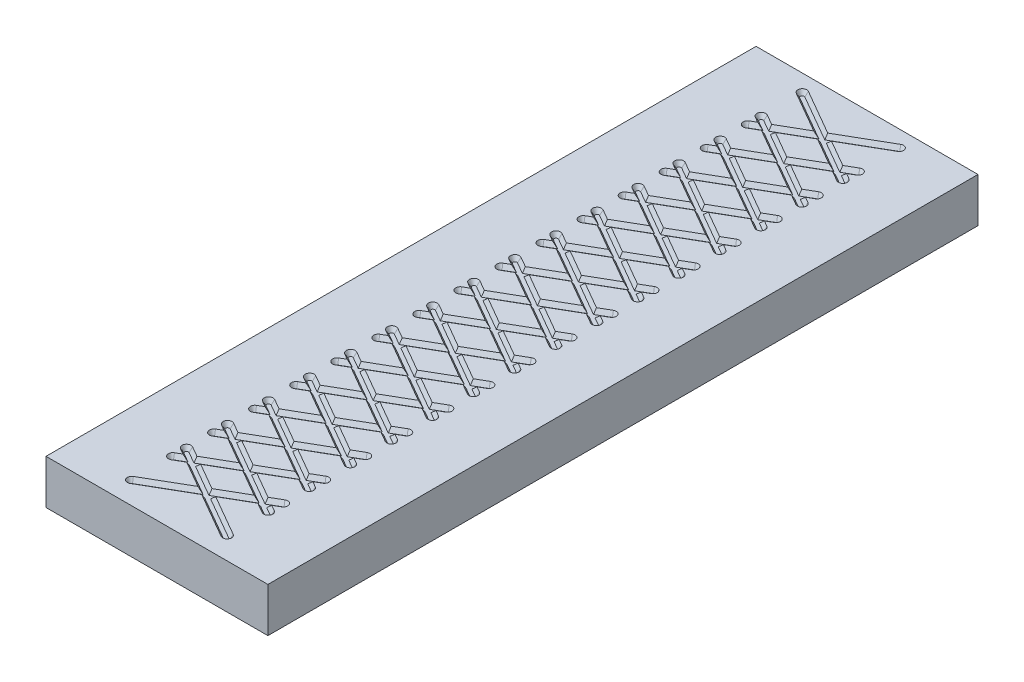
from build123d import *

# Parameters (mm, degrees)
SKETCH1_W               = 50
SKETCH1_H               = 10
BOSS_EXTRUDE1_DEPTH     = 160
CUT_EXTRUDE2_DEPTH      = 1
CUT_EXTRUDE2_DRAFT      = -30
LPATTERN1_COPY_1_DEPTH  = 1
LPATTERN1_COPY_1_DRAFT  = -30
LPATTERN1_COPY_2_DEPTH  = 1
LPATTERN1_COPY_2_DRAFT  = -30
LPATTERN1_COPY_3_DEPTH  = 1
LPATTERN1_COPY_3_DRAFT  = -30
LPATTERN1_COPY_4_DEPTH  = 1
LPATTERN1_COPY_4_DRAFT  = -30
LPATTERN1_COPY_5_DEPTH  = 1
LPATTERN1_COPY_5_DRAFT  = -30
LPATTERN1_COPY_6_DEPTH  = 1
LPATTERN1_COPY_6_DRAFT  = -30
LPATTERN1_COPY_7_DEPTH  = 1
LPATTERN1_COPY_7_DRAFT  = -30
LPATTERN1_COPY_8_DEPTH  = 1
LPATTERN1_COPY_8_DRAFT  = -30
LPATTERN1_COPY_9_DEPTH  = 1
LPATTERN1_COPY_9_DRAFT  = -30
LPATTERN1_COPY_10_DEPTH = 1
LPATTERN1_COPY_10_DRAFT = -30
LPATTERN1_COPY_11_DEPTH = 1
LPATTERN1_COPY_11_DRAFT = -30
LPATTERN1_COPY_12_DEPTH = 1
LPATTERN1_COPY_12_DRAFT = -30
LPATTERN1_COPY_13_DEPTH = 1
LPATTERN1_COPY_13_DRAFT = -30
LPATTERN1_COPY_14_DEPTH = 1
LPATTERN1_COPY_14_DRAFT = -30
LPATTERN1_COPY_15_DEPTH = 1
LPATTERN1_COPY_15_DRAFT = -30
SKETCH4_W               = 4.9
SKETCH4_H               = 9.9
CUT_EXTRUDE3_DEPTH      = 3.05
FILLET1_R               = 1


with BuildPart() as part:
    # Sketch1 → Boss-Extrude1 (new body)
    with BuildSketch(Plane.XY):
        with Locations((25, 5)):
            Rectangle(SKETCH1_W, SKETCH1_H)
    extrude(amount=-BOSS_EXTRUDE1_DEPTH)


with BuildPart() as cut_extrude2_tool:
    # Sketch2 → Cut-Extrude2 (with draft: the straight prism first)
    with BuildSketch(Plane(origin=(0, 10, 0), x_dir=(1, 0, 0), z_dir=(0, 1, 0))):
        with BuildLine():
            ThreePointArc((13.77723133, 144.666025404), (13.411205926, 143.3), (14.77723133, 142.933974596))
            Line((14.77723133, 142.933974596), (25, 148.83609284))
            Line((25, 148.83609284), (35.325317547, 142.874767974))
            ThreePointArc((35.325317547, 142.874767974), (36.691342951, 143.240793378), (36.325317547, 144.606818782))
            Line((36.325317547, 144.606818782), (27, 149.990793378))
            Line((27, 149.990793378), (36.427866425, 155.433974596))
            ThreePointArc((36.427866425, 155.433974596), (36.793891829, 156.8), (35.427866425, 157.166025404))
            Line((35.427866425, 157.166025404), (25, 151.145493916))
            Line((25, 151.145493916), (14.674682453, 157.106818782))
            ThreePointArc((14.674682453, 157.106818782), (13.308657049, 156.740793378), (13.674682453, 155.374767974))
            Line((13.674682453, 155.374767974), (23, 149.990793378))
            Line((23, 149.990793378), (13.77723133, 144.666025404))
        make_face()
    extrude(amount=-CUT_EXTRUDE2_DEPTH)
    # Cut-Extrude2: the draft: its side faces are tilted about the plane it starts from
    cut_extrude2_sides = [cut_extrude2_tool.faces().sort_by_distance(p)[0] for p in [
        (18.337341226, 9.5, -152.682780676),
        (18.388615665, 9.5, -147.328409391),
        (13.411205926, 9.5, -143.3),
        (19.888615665, 9.5, -145.885033718),
        (30.162658774, 9.5, -145.855430407),
        (36.691342951, 9.5, -143.240793378),
        (31.662658774, 9.5, -147.29880608),
        (31.713933212, 9.5, -152.712383987),
        (36.793891829, 9.5, -156.8),
        (30.213933212, 9.5, -154.15575966),
        (19.837341226, 9.5, -154.126156349),
        (13.308657049, 9.5, -156.740793378),
    ]]
    draft(cut_extrude2_sides, Plane(origin=(0, 10, 0), x_dir=(1, 0, 0), z_dir=(0, 1, 0)), CUT_EXTRUDE2_DRAFT)


with BuildPart() as part_1:
    add(part.part)

    # Cut-Extrude2: cut by cut_extrude2_tool
    add(cut_extrude2_tool.part, mode=Mode.SUBTRACT)


with BuildPart() as lpattern1_copy_1_tool:
    # LPattern1 copy 1 sketch → LPattern1 copy 1 (with draft: the straight prism first)
    with BuildSketch(Plane(origin=(0, 10, 9.25), x_dir=(1, 0, 0), z_dir=(0, 1, 0))):
        with BuildLine():
            ThreePointArc((13.77723133, 144.666025404), (13.411205926, 143.3), (14.77723133, 142.933974596))
            Line((14.77723133, 142.933974596), (25, 148.83609284))
            Line((25, 148.83609284), (35.325317547, 142.874767974))
            ThreePointArc((35.325317547, 142.874767974), (36.691342951, 143.240793378), (36.325317547, 144.606818782))
            Line((36.325317547, 144.606818782), (27, 149.990793378))
            Line((27, 149.990793378), (36.427866425, 155.433974596))
            ThreePointArc((36.427866425, 155.433974596), (36.793891829, 156.8), (35.427866425, 157.166025404))
            Line((35.427866425, 157.166025404), (25, 151.145493916))
            Line((25, 151.145493916), (14.674682453, 157.106818782))
            ThreePointArc((14.674682453, 157.106818782), (13.308657049, 156.740793378), (13.674682453, 155.374767974))
            Line((13.674682453, 155.374767974), (23, 149.990793378))
            Line((23, 149.990793378), (13.77723133, 144.666025404))
        make_face()
    extrude(amount=-LPATTERN1_COPY_1_DEPTH)
    # LPattern1 copy 1: the draft: its side faces are tilted about the plane it starts from
    lpattern1_copy_1_sides = [lpattern1_copy_1_tool.faces().sort_by_distance(p)[0] for p in [
        (18.337341226, 9.5, -143.432780676),
        (18.388615665, 9.5, -138.078409391),
        (13.411205926, 9.5, -134.05),
        (19.888615665, 9.5, -136.635033718),
        (30.162658774, 9.5, -136.605430407),
        (36.691342951, 9.5, -133.990793378),
        (31.662658774, 9.5, -138.04880608),
        (31.713933212, 9.5, -143.462383987),
        (36.793891829, 9.5, -147.55),
        (30.213933212, 9.5, -144.90575966),
        (19.837341226, 9.5, -144.876156349),
        (13.308657049, 9.5, -147.490793378),
    ]]
    draft(lpattern1_copy_1_sides, Plane(origin=(0, 10, 9.25), x_dir=(1, 0, 0), z_dir=(0, 1, 0)), LPATTERN1_COPY_1_DRAFT)


with BuildPart() as part_2:
    add(part_1.part)

    # LPattern1 copy 1: cut by lpattern1_copy_1_tool
    add(lpattern1_copy_1_tool.part, mode=Mode.SUBTRACT)


with BuildPart() as lpattern1_copy_2_tool:
    # LPattern1 copy 2 sketch → LPattern1 copy 2 (with draft: the straight prism first)
    with BuildSketch(Plane(origin=(0, 10, 18.5), x_dir=(1, 0, 0), z_dir=(0, 1, 0))):
        with BuildLine():
            ThreePointArc((13.77723133, 144.666025404), (13.411205926, 143.3), (14.77723133, 142.933974596))
            Line((14.77723133, 142.933974596), (25, 148.83609284))
            Line((25, 148.83609284), (35.325317547, 142.874767974))
            ThreePointArc((35.325317547, 142.874767974), (36.691342951, 143.240793378), (36.325317547, 144.606818782))
            Line((36.325317547, 144.606818782), (27, 149.990793378))
            Line((27, 149.990793378), (36.427866425, 155.433974596))
            ThreePointArc((36.427866425, 155.433974596), (36.793891829, 156.8), (35.427866425, 157.166025404))
            Line((35.427866425, 157.166025404), (25, 151.145493916))
            Line((25, 151.145493916), (14.674682453, 157.106818782))
            ThreePointArc((14.674682453, 157.106818782), (13.308657049, 156.740793378), (13.674682453, 155.374767974))
            Line((13.674682453, 155.374767974), (23, 149.990793378))
            Line((23, 149.990793378), (13.77723133, 144.666025404))
        make_face()
    extrude(amount=-LPATTERN1_COPY_2_DEPTH)
    # LPattern1 copy 2: the draft: its side faces are tilted about the plane it starts from
    lpattern1_copy_2_sides = [lpattern1_copy_2_tool.faces().sort_by_distance(p)[0] for p in [
        (18.337341226, 9.5, -134.182780676),
        (18.388615665, 9.5, -128.828409391),
        (13.411205926, 9.5, -124.8),
        (19.888615665, 9.5, -127.385033718),
        (30.162658774, 9.5, -127.355430407),
        (36.691342951, 9.5, -124.740793378),
        (31.662658774, 9.5, -128.79880608),
        (31.713933212, 9.5, -134.212383987),
        (36.793891829, 9.5, -138.3),
        (30.213933212, 9.5, -135.65575966),
        (19.837341226, 9.5, -135.626156349),
        (13.308657049, 9.5, -138.240793378),
    ]]
    draft(lpattern1_copy_2_sides, Plane(origin=(0, 10, 18.5), x_dir=(1, 0, 0), z_dir=(0, 1, 0)), LPATTERN1_COPY_2_DRAFT)


with BuildPart() as part_3:
    add(part_2.part)

    # LPattern1 copy 2: cut by lpattern1_copy_2_tool
    add(lpattern1_copy_2_tool.part, mode=Mode.SUBTRACT)


with BuildPart() as lpattern1_copy_3_tool:
    # LPattern1 copy 3 sketch → LPattern1 copy 3 (with draft: the straight prism first)
    with BuildSketch(Plane(origin=(0, 10, 27.75), x_dir=(1, 0, 0), z_dir=(0, 1, 0))):
        with BuildLine():
            ThreePointArc((13.77723133, 144.666025404), (13.411205926, 143.3), (14.77723133, 142.933974596))
            Line((14.77723133, 142.933974596), (25, 148.83609284))
            Line((25, 148.83609284), (35.325317547, 142.874767974))
            ThreePointArc((35.325317547, 142.874767974), (36.691342951, 143.240793378), (36.325317547, 144.606818782))
            Line((36.325317547, 144.606818782), (27, 149.990793378))
            Line((27, 149.990793378), (36.427866425, 155.433974596))
            ThreePointArc((36.427866425, 155.433974596), (36.793891829, 156.8), (35.427866425, 157.166025404))
            Line((35.427866425, 157.166025404), (25, 151.145493916))
            Line((25, 151.145493916), (14.674682453, 157.106818782))
            ThreePointArc((14.674682453, 157.106818782), (13.308657049, 156.740793378), (13.674682453, 155.374767974))
            Line((13.674682453, 155.374767974), (23, 149.990793378))
            Line((23, 149.990793378), (13.77723133, 144.666025404))
        make_face()
    extrude(amount=-LPATTERN1_COPY_3_DEPTH)
    # LPattern1 copy 3: the draft: its side faces are tilted about the plane it starts from
    lpattern1_copy_3_sides = [lpattern1_copy_3_tool.faces().sort_by_distance(p)[0] for p in [
        (18.337341226, 9.5, -124.932780676),
        (18.388615665, 9.5, -119.578409391),
        (13.411205926, 9.5, -115.55),
        (19.888615665, 9.5, -118.135033718),
        (30.162658774, 9.5, -118.105430407),
        (36.691342951, 9.5, -115.490793378),
        (31.662658774, 9.5, -119.54880608),
        (31.713933212, 9.5, -124.962383987),
        (36.793891829, 9.5, -129.05),
        (30.213933212, 9.5, -126.40575966),
        (19.837341226, 9.5, -126.376156349),
        (13.308657049, 9.5, -128.990793378),
    ]]
    draft(lpattern1_copy_3_sides, Plane(origin=(0, 10, 27.75), x_dir=(1, 0, 0), z_dir=(0, 1, 0)), LPATTERN1_COPY_3_DRAFT)


with BuildPart() as part_4:
    add(part_3.part)

    # LPattern1 copy 3: cut by lpattern1_copy_3_tool
    add(lpattern1_copy_3_tool.part, mode=Mode.SUBTRACT)


with BuildPart() as lpattern1_copy_4_tool:
    # LPattern1 copy 4 sketch → LPattern1 copy 4 (with draft: the straight prism first)
    with BuildSketch(Plane(origin=(0, 10, 37), x_dir=(1, 0, 0), z_dir=(0, 1, 0))):
        with BuildLine():
            ThreePointArc((13.77723133, 144.666025404), (13.411205926, 143.3), (14.77723133, 142.933974596))
            Line((14.77723133, 142.933974596), (25, 148.83609284))
            Line((25, 148.83609284), (35.325317547, 142.874767974))
            ThreePointArc((35.325317547, 142.874767974), (36.691342951, 143.240793378), (36.325317547, 144.606818782))
            Line((36.325317547, 144.606818782), (27, 149.990793378))
            Line((27, 149.990793378), (36.427866425, 155.433974596))
            ThreePointArc((36.427866425, 155.433974596), (36.793891829, 156.8), (35.427866425, 157.166025404))
            Line((35.427866425, 157.166025404), (25, 151.145493916))
            Line((25, 151.145493916), (14.674682453, 157.106818782))
            ThreePointArc((14.674682453, 157.106818782), (13.308657049, 156.740793378), (13.674682453, 155.374767974))
            Line((13.674682453, 155.374767974), (23, 149.990793378))
            Line((23, 149.990793378), (13.77723133, 144.666025404))
        make_face()
    extrude(amount=-LPATTERN1_COPY_4_DEPTH)
    # LPattern1 copy 4: the draft: its side faces are tilted about the plane it starts from
    lpattern1_copy_4_sides = [lpattern1_copy_4_tool.faces().sort_by_distance(p)[0] for p in [
        (18.337341226, 9.5, -115.682780676),
        (18.388615665, 9.5, -110.328409391),
        (13.411205926, 9.5, -106.3),
        (19.888615665, 9.5, -108.885033718),
        (30.162658774, 9.5, -108.855430407),
        (36.691342951, 9.5, -106.240793378),
        (31.662658774, 9.5, -110.29880608),
        (31.713933212, 9.5, -115.712383987),
        (36.793891829, 9.5, -119.8),
        (30.213933212, 9.5, -117.15575966),
        (19.837341226, 9.5, -117.126156349),
        (13.308657049, 9.5, -119.740793378),
    ]]
    draft(lpattern1_copy_4_sides, Plane(origin=(0, 10, 37), x_dir=(1, 0, 0), z_dir=(0, 1, 0)), LPATTERN1_COPY_4_DRAFT)


with BuildPart() as part_5:
    add(part_4.part)

    # LPattern1 copy 4: cut by lpattern1_copy_4_tool
    add(lpattern1_copy_4_tool.part, mode=Mode.SUBTRACT)


with BuildPart() as lpattern1_copy_5_tool:
    # LPattern1 copy 5 sketch → LPattern1 copy 5 (with draft: the straight prism first)
    with BuildSketch(Plane(origin=(0, 10, 46.25), x_dir=(1, 0, 0), z_dir=(0, 1, 0))):
        with BuildLine():
            ThreePointArc((13.77723133, 144.666025404), (13.411205926, 143.3), (14.77723133, 142.933974596))
            Line((14.77723133, 142.933974596), (25, 148.83609284))
            Line((25, 148.83609284), (35.325317547, 142.874767974))
            ThreePointArc((35.325317547, 142.874767974), (36.691342951, 143.240793378), (36.325317547, 144.606818782))
            Line((36.325317547, 144.606818782), (27, 149.990793378))
            Line((27, 149.990793378), (36.427866425, 155.433974596))
            ThreePointArc((36.427866425, 155.433974596), (36.793891829, 156.8), (35.427866425, 157.166025404))
            Line((35.427866425, 157.166025404), (25, 151.145493916))
            Line((25, 151.145493916), (14.674682453, 157.106818782))
            ThreePointArc((14.674682453, 157.106818782), (13.308657049, 156.740793378), (13.674682453, 155.374767974))
            Line((13.674682453, 155.374767974), (23, 149.990793378))
            Line((23, 149.990793378), (13.77723133, 144.666025404))
        make_face()
    extrude(amount=-LPATTERN1_COPY_5_DEPTH)
    # LPattern1 copy 5: the draft: its side faces are tilted about the plane it starts from
    lpattern1_copy_5_sides = [lpattern1_copy_5_tool.faces().sort_by_distance(p)[0] for p in [
        (18.337341226, 9.5, -106.432780676),
        (18.388615665, 9.5, -101.078409391),
        (13.411205926, 9.5, -97.05),
        (19.888615665, 9.5, -99.635033718),
        (30.162658774, 9.5, -99.605430407),
        (36.691342951, 9.5, -96.990793378),
        (31.662658774, 9.5, -101.04880608),
        (31.713933212, 9.5, -106.462383987),
        (36.793891829, 9.5, -110.55),
        (30.213933212, 9.5, -107.90575966),
        (19.837341226, 9.5, -107.876156349),
        (13.308657049, 9.5, -110.490793378),
    ]]
    draft(lpattern1_copy_5_sides, Plane(origin=(0, 10, 46.25), x_dir=(1, 0, 0), z_dir=(0, 1, 0)), LPATTERN1_COPY_5_DRAFT)


with BuildPart() as part_6:
    add(part_5.part)

    # LPattern1 copy 5: cut by lpattern1_copy_5_tool
    add(lpattern1_copy_5_tool.part, mode=Mode.SUBTRACT)


with BuildPart() as lpattern1_copy_6_tool:
    # LPattern1 copy 6 sketch → LPattern1 copy 6 (with draft: the straight prism first)
    with BuildSketch(Plane(origin=(0, 10, 55.5), x_dir=(1, 0, 0), z_dir=(0, 1, 0))):
        with BuildLine():
            ThreePointArc((13.77723133, 144.666025404), (13.411205926, 143.3), (14.77723133, 142.933974596))
            Line((14.77723133, 142.933974596), (25, 148.83609284))
            Line((25, 148.83609284), (35.325317547, 142.874767974))
            ThreePointArc((35.325317547, 142.874767974), (36.691342951, 143.240793378), (36.325317547, 144.606818782))
            Line((36.325317547, 144.606818782), (27, 149.990793378))
            Line((27, 149.990793378), (36.427866425, 155.433974596))
            ThreePointArc((36.427866425, 155.433974596), (36.793891829, 156.8), (35.427866425, 157.166025404))
            Line((35.427866425, 157.166025404), (25, 151.145493916))
            Line((25, 151.145493916), (14.674682453, 157.106818782))
            ThreePointArc((14.674682453, 157.106818782), (13.308657049, 156.740793378), (13.674682453, 155.374767974))
            Line((13.674682453, 155.374767974), (23, 149.990793378))
            Line((23, 149.990793378), (13.77723133, 144.666025404))
        make_face()
    extrude(amount=-LPATTERN1_COPY_6_DEPTH)
    # LPattern1 copy 6: the draft: its side faces are tilted about the plane it starts from
    lpattern1_copy_6_sides = [lpattern1_copy_6_tool.faces().sort_by_distance(p)[0] for p in [
        (18.337341226, 9.5, -97.182780676),
        (18.388615665, 9.5, -91.828409391),
        (13.411205926, 9.5, -87.8),
        (19.888615665, 9.5, -90.385033718),
        (30.162658774, 9.5, -90.355430407),
        (36.691342951, 9.5, -87.740793378),
        (31.662658774, 9.5, -91.79880608),
        (31.713933212, 9.5, -97.212383987),
        (36.793891829, 9.5, -101.3),
        (30.213933212, 9.5, -98.65575966),
        (19.837341226, 9.5, -98.626156349),
        (13.308657049, 9.5, -101.240793378),
    ]]
    draft(lpattern1_copy_6_sides, Plane(origin=(0, 10, 55.5), x_dir=(1, 0, 0), z_dir=(0, 1, 0)), LPATTERN1_COPY_6_DRAFT)


with BuildPart() as part_7:
    add(part_6.part)

    # LPattern1 copy 6: cut by lpattern1_copy_6_tool
    add(lpattern1_copy_6_tool.part, mode=Mode.SUBTRACT)


with BuildPart() as lpattern1_copy_7_tool:
    # LPattern1 copy 7 sketch → LPattern1 copy 7 (with draft: the straight prism first)
    with BuildSketch(Plane(origin=(0, 10, 64.75), x_dir=(1, 0, 0), z_dir=(0, 1, 0))):
        with BuildLine():
            ThreePointArc((13.77723133, 144.666025404), (13.411205926, 143.3), (14.77723133, 142.933974596))
            Line((14.77723133, 142.933974596), (25, 148.83609284))
            Line((25, 148.83609284), (35.325317547, 142.874767974))
            ThreePointArc((35.325317547, 142.874767974), (36.691342951, 143.240793378), (36.325317547, 144.606818782))
            Line((36.325317547, 144.606818782), (27, 149.990793378))
            Line((27, 149.990793378), (36.427866425, 155.433974596))
            ThreePointArc((36.427866425, 155.433974596), (36.793891829, 156.8), (35.427866425, 157.166025404))
            Line((35.427866425, 157.166025404), (25, 151.145493916))
            Line((25, 151.145493916), (14.674682453, 157.106818782))
            ThreePointArc((14.674682453, 157.106818782), (13.308657049, 156.740793378), (13.674682453, 155.374767974))
            Line((13.674682453, 155.374767974), (23, 149.990793378))
            Line((23, 149.990793378), (13.77723133, 144.666025404))
        make_face()
    extrude(amount=-LPATTERN1_COPY_7_DEPTH)
    # LPattern1 copy 7: the draft: its side faces are tilted about the plane it starts from
    lpattern1_copy_7_sides = [lpattern1_copy_7_tool.faces().sort_by_distance(p)[0] for p in [
        (18.337341226, 9.5, -87.932780676),
        (18.388615665, 9.5, -82.578409391),
        (13.411205926, 9.5, -78.55),
        (19.888615665, 9.5, -81.135033718),
        (30.162658774, 9.5, -81.105430407),
        (36.691342951, 9.5, -78.490793378),
        (31.662658774, 9.5, -82.54880608),
        (31.713933212, 9.5, -87.962383987),
        (36.793891829, 9.5, -92.05),
        (30.213933212, 9.5, -89.40575966),
        (19.837341226, 9.5, -89.376156349),
        (13.308657049, 9.5, -91.990793378),
    ]]
    draft(lpattern1_copy_7_sides, Plane(origin=(0, 10, 64.75), x_dir=(1, 0, 0), z_dir=(0, 1, 0)), LPATTERN1_COPY_7_DRAFT)


with BuildPart() as part_8:
    add(part_7.part)

    # LPattern1 copy 7: cut by lpattern1_copy_7_tool
    add(lpattern1_copy_7_tool.part, mode=Mode.SUBTRACT)


with BuildPart() as lpattern1_copy_8_tool:
    # LPattern1 copy 8 sketch → LPattern1 copy 8 (with draft: the straight prism first)
    with BuildSketch(Plane(origin=(0, 10, 74), x_dir=(1, 0, 0), z_dir=(0, 1, 0))):
        with BuildLine():
            ThreePointArc((13.77723133, 144.666025404), (13.411205926, 143.3), (14.77723133, 142.933974596))
            Line((14.77723133, 142.933974596), (25, 148.83609284))
            Line((25, 148.83609284), (35.325317547, 142.874767974))
            ThreePointArc((35.325317547, 142.874767974), (36.691342951, 143.240793378), (36.325317547, 144.606818782))
            Line((36.325317547, 144.606818782), (27, 149.990793378))
            Line((27, 149.990793378), (36.427866425, 155.433974596))
            ThreePointArc((36.427866425, 155.433974596), (36.793891829, 156.8), (35.427866425, 157.166025404))
            Line((35.427866425, 157.166025404), (25, 151.145493916))
            Line((25, 151.145493916), (14.674682453, 157.106818782))
            ThreePointArc((14.674682453, 157.106818782), (13.308657049, 156.740793378), (13.674682453, 155.374767974))
            Line((13.674682453, 155.374767974), (23, 149.990793378))
            Line((23, 149.990793378), (13.77723133, 144.666025404))
        make_face()
    extrude(amount=-LPATTERN1_COPY_8_DEPTH)
    # LPattern1 copy 8: the draft: its side faces are tilted about the plane it starts from
    lpattern1_copy_8_sides = [lpattern1_copy_8_tool.faces().sort_by_distance(p)[0] for p in [
        (18.337341226, 9.5, -78.682780676),
        (18.388615665, 9.5, -73.328409391),
        (13.411205926, 9.5, -69.3),
        (19.888615665, 9.5, -71.885033718),
        (30.162658774, 9.5, -71.855430407),
        (36.691342951, 9.5, -69.240793378),
        (31.662658774, 9.5, -73.29880608),
        (31.713933212, 9.5, -78.712383987),
        (36.793891829, 9.5, -82.8),
        (30.213933212, 9.5, -80.15575966),
        (19.837341226, 9.5, -80.126156349),
        (13.308657049, 9.5, -82.740793378),
    ]]
    draft(lpattern1_copy_8_sides, Plane(origin=(0, 10, 74), x_dir=(1, 0, 0), z_dir=(0, 1, 0)), LPATTERN1_COPY_8_DRAFT)


with BuildPart() as part_9:
    add(part_8.part)

    # LPattern1 copy 8: cut by lpattern1_copy_8_tool
    add(lpattern1_copy_8_tool.part, mode=Mode.SUBTRACT)


with BuildPart() as lpattern1_copy_9_tool:
    # LPattern1 copy 9 sketch → LPattern1 copy 9 (with draft: the straight prism first)
    with BuildSketch(Plane(origin=(0, 10, 83.25), x_dir=(1, 0, 0), z_dir=(0, 1, 0))):
        with BuildLine():
            ThreePointArc((13.77723133, 144.666025404), (13.411205926, 143.3), (14.77723133, 142.933974596))
            Line((14.77723133, 142.933974596), (25, 148.83609284))
            Line((25, 148.83609284), (35.325317547, 142.874767974))
            ThreePointArc((35.325317547, 142.874767974), (36.691342951, 143.240793378), (36.325317547, 144.606818782))
            Line((36.325317547, 144.606818782), (27, 149.990793378))
            Line((27, 149.990793378), (36.427866425, 155.433974596))
            ThreePointArc((36.427866425, 155.433974596), (36.793891829, 156.8), (35.427866425, 157.166025404))
            Line((35.427866425, 157.166025404), (25, 151.145493916))
            Line((25, 151.145493916), (14.674682453, 157.106818782))
            ThreePointArc((14.674682453, 157.106818782), (13.308657049, 156.740793378), (13.674682453, 155.374767974))
            Line((13.674682453, 155.374767974), (23, 149.990793378))
            Line((23, 149.990793378), (13.77723133, 144.666025404))
        make_face()
    extrude(amount=-LPATTERN1_COPY_9_DEPTH)
    # LPattern1 copy 9: the draft: its side faces are tilted about the plane it starts from
    lpattern1_copy_9_sides = [lpattern1_copy_9_tool.faces().sort_by_distance(p)[0] for p in [
        (18.337341226, 9.5, -69.432780676),
        (18.388615665, 9.5, -64.078409391),
        (13.411205926, 9.5, -60.05),
        (19.888615665, 9.5, -62.635033718),
        (30.162658774, 9.5, -62.605430407),
        (36.691342951, 9.5, -59.990793378),
        (31.662658774, 9.5, -64.04880608),
        (31.713933212, 9.5, -69.462383987),
        (36.793891829, 9.5, -73.55),
        (30.213933212, 9.5, -70.90575966),
        (19.837341226, 9.5, -70.876156349),
        (13.308657049, 9.5, -73.490793378),
    ]]
    draft(lpattern1_copy_9_sides, Plane(origin=(0, 10, 83.25), x_dir=(1, 0, 0), z_dir=(0, 1, 0)), LPATTERN1_COPY_9_DRAFT)


with BuildPart() as part_10:
    add(part_9.part)

    # LPattern1 copy 9: cut by lpattern1_copy_9_tool
    add(lpattern1_copy_9_tool.part, mode=Mode.SUBTRACT)


with BuildPart() as lpattern1_copy_10_tool:
    # LPattern1 copy 10 sketch → LPattern1 copy 10 (with draft: the straight prism first)
    with BuildSketch(Plane(origin=(0, 10, 92.5), x_dir=(1, 0, 0), z_dir=(0, 1, 0))):
        with BuildLine():
            ThreePointArc((13.77723133, 144.666025404), (13.411205926, 143.3), (14.77723133, 142.933974596))
            Line((14.77723133, 142.933974596), (25, 148.83609284))
            Line((25, 148.83609284), (35.325317547, 142.874767974))
            ThreePointArc((35.325317547, 142.874767974), (36.691342951, 143.240793378), (36.325317547, 144.606818782))
            Line((36.325317547, 144.606818782), (27, 149.990793378))
            Line((27, 149.990793378), (36.427866425, 155.433974596))
            ThreePointArc((36.427866425, 155.433974596), (36.793891829, 156.8), (35.427866425, 157.166025404))
            Line((35.427866425, 157.166025404), (25, 151.145493916))
            Line((25, 151.145493916), (14.674682453, 157.106818782))
            ThreePointArc((14.674682453, 157.106818782), (13.308657049, 156.740793378), (13.674682453, 155.374767974))
            Line((13.674682453, 155.374767974), (23, 149.990793378))
            Line((23, 149.990793378), (13.77723133, 144.666025404))
        make_face()
    extrude(amount=-LPATTERN1_COPY_10_DEPTH)
    # LPattern1 copy 10: the draft: its side faces are tilted about the plane it starts from
    lpattern1_copy_10_sides = [lpattern1_copy_10_tool.faces().sort_by_distance(p)[0] for p in [
        (18.337341226, 9.5, -60.182780676),
        (18.388615665, 9.5, -54.828409391),
        (13.411205926, 9.5, -50.8),
        (19.888615665, 9.5, -53.385033718),
        (30.162658774, 9.5, -53.355430407),
        (36.691342951, 9.5, -50.740793378),
        (31.662658774, 9.5, -54.79880608),
        (31.713933212, 9.5, -60.212383987),
        (36.793891829, 9.5, -64.3),
        (30.213933212, 9.5, -61.65575966),
        (19.837341226, 9.5, -61.626156349),
        (13.308657049, 9.5, -64.240793378),
    ]]
    draft(lpattern1_copy_10_sides, Plane(origin=(0, 10, 92.5), x_dir=(1, 0, 0), z_dir=(0, 1, 0)), LPATTERN1_COPY_10_DRAFT)


with BuildPart() as part_11:
    add(part_10.part)

    # LPattern1 copy 10: cut by lpattern1_copy_10_tool
    add(lpattern1_copy_10_tool.part, mode=Mode.SUBTRACT)


with BuildPart() as lpattern1_copy_11_tool:
    # LPattern1 copy 11 sketch → LPattern1 copy 11 (with draft: the straight prism first)
    with BuildSketch(Plane(origin=(0, 10, 101.75), x_dir=(1, 0, 0), z_dir=(0, 1, 0))):
        with BuildLine():
            ThreePointArc((13.77723133, 144.666025404), (13.411205926, 143.3), (14.77723133, 142.933974596))
            Line((14.77723133, 142.933974596), (25, 148.83609284))
            Line((25, 148.83609284), (35.325317547, 142.874767974))
            ThreePointArc((35.325317547, 142.874767974), (36.691342951, 143.240793378), (36.325317547, 144.606818782))
            Line((36.325317547, 144.606818782), (27, 149.990793378))
            Line((27, 149.990793378), (36.427866425, 155.433974596))
            ThreePointArc((36.427866425, 155.433974596), (36.793891829, 156.8), (35.427866425, 157.166025404))
            Line((35.427866425, 157.166025404), (25, 151.145493916))
            Line((25, 151.145493916), (14.674682453, 157.106818782))
            ThreePointArc((14.674682453, 157.106818782), (13.308657049, 156.740793378), (13.674682453, 155.374767974))
            Line((13.674682453, 155.374767974), (23, 149.990793378))
            Line((23, 149.990793378), (13.77723133, 144.666025404))
        make_face()
    extrude(amount=-LPATTERN1_COPY_11_DEPTH)
    # LPattern1 copy 11: the draft: its side faces are tilted about the plane it starts from
    lpattern1_copy_11_sides = [lpattern1_copy_11_tool.faces().sort_by_distance(p)[0] for p in [
        (18.337341226, 9.5, -50.932780676),
        (18.388615665, 9.5, -45.578409391),
        (13.411205926, 9.5, -41.55),
        (19.888615665, 9.5, -44.135033718),
        (30.162658774, 9.5, -44.105430407),
        (36.691342951, 9.5, -41.490793378),
        (31.662658774, 9.5, -45.54880608),
        (31.713933212, 9.5, -50.962383987),
        (36.793891829, 9.5, -55.05),
        (30.213933212, 9.5, -52.40575966),
        (19.837341226, 9.5, -52.376156349),
        (13.308657049, 9.5, -54.990793378),
    ]]
    draft(lpattern1_copy_11_sides, Plane(origin=(0, 10, 101.75), x_dir=(1, 0, 0), z_dir=(0, 1, 0)), LPATTERN1_COPY_11_DRAFT)


with BuildPart() as part_12:
    add(part_11.part)

    # LPattern1 copy 11: cut by lpattern1_copy_11_tool
    add(lpattern1_copy_11_tool.part, mode=Mode.SUBTRACT)


with BuildPart() as lpattern1_copy_12_tool:
    # LPattern1 copy 12 sketch → LPattern1 copy 12 (with draft: the straight prism first)
    with BuildSketch(Plane(origin=(0, 10, 111), x_dir=(1, 0, 0), z_dir=(0, 1, 0))):
        with BuildLine():
            ThreePointArc((13.77723133, 144.666025404), (13.411205926, 143.3), (14.77723133, 142.933974596))
            Line((14.77723133, 142.933974596), (25, 148.83609284))
            Line((25, 148.83609284), (35.325317547, 142.874767974))
            ThreePointArc((35.325317547, 142.874767974), (36.691342951, 143.240793378), (36.325317547, 144.606818782))
            Line((36.325317547, 144.606818782), (27, 149.990793378))
            Line((27, 149.990793378), (36.427866425, 155.433974596))
            ThreePointArc((36.427866425, 155.433974596), (36.793891829, 156.8), (35.427866425, 157.166025404))
            Line((35.427866425, 157.166025404), (25, 151.145493916))
            Line((25, 151.145493916), (14.674682453, 157.106818782))
            ThreePointArc((14.674682453, 157.106818782), (13.308657049, 156.740793378), (13.674682453, 155.374767974))
            Line((13.674682453, 155.374767974), (23, 149.990793378))
            Line((23, 149.990793378), (13.77723133, 144.666025404))
        make_face()
    extrude(amount=-LPATTERN1_COPY_12_DEPTH)
    # LPattern1 copy 12: the draft: its side faces are tilted about the plane it starts from
    lpattern1_copy_12_sides = [lpattern1_copy_12_tool.faces().sort_by_distance(p)[0] for p in [
        (18.337341226, 9.5, -41.682780676),
        (18.388615665, 9.5, -36.328409391),
        (13.411205926, 9.5, -32.3),
        (19.888615665, 9.5, -34.885033718),
        (30.162658774, 9.5, -34.855430407),
        (36.691342951, 9.5, -32.240793378),
        (31.662658774, 9.5, -36.29880608),
        (31.713933212, 9.5, -41.712383987),
        (36.793891829, 9.5, -45.8),
        (30.213933212, 9.5, -43.15575966),
        (19.837341226, 9.5, -43.126156349),
        (13.308657049, 9.5, -45.740793378),
    ]]
    draft(lpattern1_copy_12_sides, Plane(origin=(0, 10, 111), x_dir=(1, 0, 0), z_dir=(0, 1, 0)), LPATTERN1_COPY_12_DRAFT)


with BuildPart() as part_13:
    add(part_12.part)

    # LPattern1 copy 12: cut by lpattern1_copy_12_tool
    add(lpattern1_copy_12_tool.part, mode=Mode.SUBTRACT)


with BuildPart() as lpattern1_copy_13_tool:
    # LPattern1 copy 13 sketch → LPattern1 copy 13 (with draft: the straight prism first)
    with BuildSketch(Plane(origin=(0, 10, 120.25), x_dir=(1, 0, 0), z_dir=(0, 1, 0))):
        with BuildLine():
            ThreePointArc((13.77723133, 144.666025404), (13.411205926, 143.3), (14.77723133, 142.933974596))
            Line((14.77723133, 142.933974596), (25, 148.83609284))
            Line((25, 148.83609284), (35.325317547, 142.874767974))
            ThreePointArc((35.325317547, 142.874767974), (36.691342951, 143.240793378), (36.325317547, 144.606818782))
            Line((36.325317547, 144.606818782), (27, 149.990793378))
            Line((27, 149.990793378), (36.427866425, 155.433974596))
            ThreePointArc((36.427866425, 155.433974596), (36.793891829, 156.8), (35.427866425, 157.166025404))
            Line((35.427866425, 157.166025404), (25, 151.145493916))
            Line((25, 151.145493916), (14.674682453, 157.106818782))
            ThreePointArc((14.674682453, 157.106818782), (13.308657049, 156.740793378), (13.674682453, 155.374767974))
            Line((13.674682453, 155.374767974), (23, 149.990793378))
            Line((23, 149.990793378), (13.77723133, 144.666025404))
        make_face()
    extrude(amount=-LPATTERN1_COPY_13_DEPTH)
    # LPattern1 copy 13: the draft: its side faces are tilted about the plane it starts from
    lpattern1_copy_13_sides = [lpattern1_copy_13_tool.faces().sort_by_distance(p)[0] for p in [
        (18.337341226, 9.5, -32.432780676),
        (18.388615665, 9.5, -27.078409391),
        (13.411205926, 9.5, -23.05),
        (19.888615665, 9.5, -25.635033718),
        (30.162658774, 9.5, -25.605430407),
        (36.691342951, 9.5, -22.990793378),
        (31.662658774, 9.5, -27.04880608),
        (31.713933212, 9.5, -32.462383987),
        (36.793891829, 9.5, -36.55),
        (30.213933212, 9.5, -33.90575966),
        (19.837341226, 9.5, -33.876156349),
        (13.308657049, 9.5, -36.490793378),
    ]]
    draft(lpattern1_copy_13_sides, Plane(origin=(0, 10, 120.25), x_dir=(1, 0, 0), z_dir=(0, 1, 0)), LPATTERN1_COPY_13_DRAFT)


with BuildPart() as part_14:
    add(part_13.part)

    # LPattern1 copy 13: cut by lpattern1_copy_13_tool
    add(lpattern1_copy_13_tool.part, mode=Mode.SUBTRACT)


with BuildPart() as lpattern1_copy_14_tool:
    # LPattern1 copy 14 sketch → LPattern1 copy 14 (with draft: the straight prism first)
    with BuildSketch(Plane(origin=(0, 10, 129.5), x_dir=(1, 0, 0), z_dir=(0, 1, 0))):
        with BuildLine():
            ThreePointArc((13.77723133, 144.666025404), (13.411205926, 143.3), (14.77723133, 142.933974596))
            Line((14.77723133, 142.933974596), (25, 148.83609284))
            Line((25, 148.83609284), (35.325317547, 142.874767974))
            ThreePointArc((35.325317547, 142.874767974), (36.691342951, 143.240793378), (36.325317547, 144.606818782))
            Line((36.325317547, 144.606818782), (27, 149.990793378))
            Line((27, 149.990793378), (36.427866425, 155.433974596))
            ThreePointArc((36.427866425, 155.433974596), (36.793891829, 156.8), (35.427866425, 157.166025404))
            Line((35.427866425, 157.166025404), (25, 151.145493916))
            Line((25, 151.145493916), (14.674682453, 157.106818782))
            ThreePointArc((14.674682453, 157.106818782), (13.308657049, 156.740793378), (13.674682453, 155.374767974))
            Line((13.674682453, 155.374767974), (23, 149.990793378))
            Line((23, 149.990793378), (13.77723133, 144.666025404))
        make_face()
    extrude(amount=-LPATTERN1_COPY_14_DEPTH)
    # LPattern1 copy 14: the draft: its side faces are tilted about the plane it starts from
    lpattern1_copy_14_sides = [lpattern1_copy_14_tool.faces().sort_by_distance(p)[0] for p in [
        (18.337341226, 9.5, -23.182780676),
        (18.388615665, 9.5, -17.828409391),
        (13.411205926, 9.5, -13.8),
        (19.888615665, 9.5, -16.385033718),
        (30.162658774, 9.5, -16.355430407),
        (36.691342951, 9.5, -13.740793378),
        (31.662658774, 9.5, -17.79880608),
        (31.713933212, 9.5, -23.212383987),
        (36.793891829, 9.5, -27.3),
        (30.213933212, 9.5, -24.65575966),
        (19.837341226, 9.5, -24.626156349),
        (13.308657049, 9.5, -27.240793378),
    ]]
    draft(lpattern1_copy_14_sides, Plane(origin=(0, 10, 129.5), x_dir=(1, 0, 0), z_dir=(0, 1, 0)), LPATTERN1_COPY_14_DRAFT)


with BuildPart() as part_15:
    add(part_14.part)

    # LPattern1 copy 14: cut by lpattern1_copy_14_tool
    add(lpattern1_copy_14_tool.part, mode=Mode.SUBTRACT)


with BuildPart() as lpattern1_copy_15_tool:
    # LPattern1 copy 15 sketch → LPattern1 copy 15 (with draft: the straight prism first)
    with BuildSketch(Plane(origin=(0, 10, 138.75), x_dir=(1, 0, 0), z_dir=(0, 1, 0))):
        with BuildLine():
            ThreePointArc((13.77723133, 144.666025404), (13.411205926, 143.3), (14.77723133, 142.933974596))
            Line((14.77723133, 142.933974596), (25, 148.83609284))
            Line((25, 148.83609284), (35.325317547, 142.874767974))
            ThreePointArc((35.325317547, 142.874767974), (36.691342951, 143.240793378), (36.325317547, 144.606818782))
            Line((36.325317547, 144.606818782), (27, 149.990793378))
            Line((27, 149.990793378), (36.427866425, 155.433974596))
            ThreePointArc((36.427866425, 155.433974596), (36.793891829, 156.8), (35.427866425, 157.166025404))
            Line((35.427866425, 157.166025404), (25, 151.145493916))
            Line((25, 151.145493916), (14.674682453, 157.106818782))
            ThreePointArc((14.674682453, 157.106818782), (13.308657049, 156.740793378), (13.674682453, 155.374767974))
            Line((13.674682453, 155.374767974), (23, 149.990793378))
            Line((23, 149.990793378), (13.77723133, 144.666025404))
        make_face()
    extrude(amount=-LPATTERN1_COPY_15_DEPTH)
    # LPattern1 copy 15: the draft: its side faces are tilted about the plane it starts from
    lpattern1_copy_15_sides = [lpattern1_copy_15_tool.faces().sort_by_distance(p)[0] for p in [
        (18.337341226, 9.5, -13.932780676),
        (18.388615665, 9.5, -8.578409391),
        (13.411205926, 9.5, -4.55),
        (19.888615665, 9.5, -7.135033718),
        (30.162658774, 9.5, -7.105430407),
        (36.691342951, 9.5, -4.490793378),
        (31.662658774, 9.5, -8.54880608),
        (31.713933212, 9.5, -13.962383987),
        (36.793891829, 9.5, -18.05),
        (30.213933212, 9.5, -15.40575966),
        (19.837341226, 9.5, -15.376156349),
        (13.308657049, 9.5, -17.990793378),
    ]]
    draft(lpattern1_copy_15_sides, Plane(origin=(0, 10, 138.75), x_dir=(1, 0, 0), z_dir=(0, 1, 0)), LPATTERN1_COPY_15_DRAFT)


with BuildPart() as part_16:
    add(part_15.part)

    # LPattern1 copy 15: cut by lpattern1_copy_15_tool
    add(lpattern1_copy_15_tool.part, mode=Mode.SUBTRACT)

    # Sketch4 → Cut-Extrude3 (cut)
    with BuildSketch(Plane.XZ):
        with Locations((25, -43.75)):
            Rectangle(SKETCH4_W, SKETCH4_H)
    cut_extrude3 = extrude(amount=-CUT_EXTRUDE3_DEPTH, mode=Mode.SUBTRACT)

    # Fillet1
    fillet1_edges = [part_16.edges().sort_by_distance(p)[0] for p in [
        (25, 3.05, -48.7),
        (22.55, 3.05, -43.75),
        (25, 3.05, -38.8),
        (27.45, 3.05, -43.75),
        (25, 0, -48.7),
        (27.45, 0, -43.75),
        (25, 0, -38.8),
        (22.55, 0, -43.75),
    ]]
    fillet(fillet1_edges, radius=FILLET1_R)

    # Mirror1: Cut-Extrude3 across plane
    add(cut_extrude3.mirror(Plane.XY.offset(-80)), mode=Mode.SUBTRACT)


solid = part_16.part
